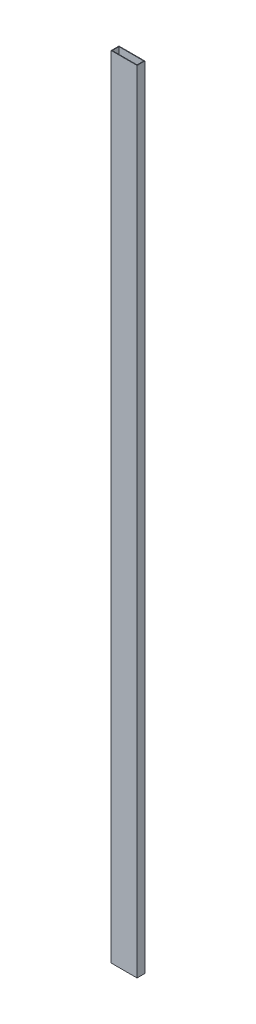
from build123d import *

# Parameters (mm, degrees)
SKETCH1_W           = 100
SKETCH1_H           = 30
SKETCH1_W_2         = 96
SKETCH1_H_2         = 26
BOSS_EXTRUDE1_DEPTH = 3050


with BuildPart() as part:
    # Sketch1 → Boss-Extrude1 (new body)
    with BuildSketch(Plane(origin=(0, 0, 0), x_dir=(1, 0, 0), z_dir=(0, 1, 0))):
        Rectangle(SKETCH1_W, SKETCH1_H)
        Rectangle(SKETCH1_W_2, SKETCH1_H_2, mode=Mode.SUBTRACT)
    extrude(amount=BOSS_EXTRUDE1_DEPTH)


solid = part.part
